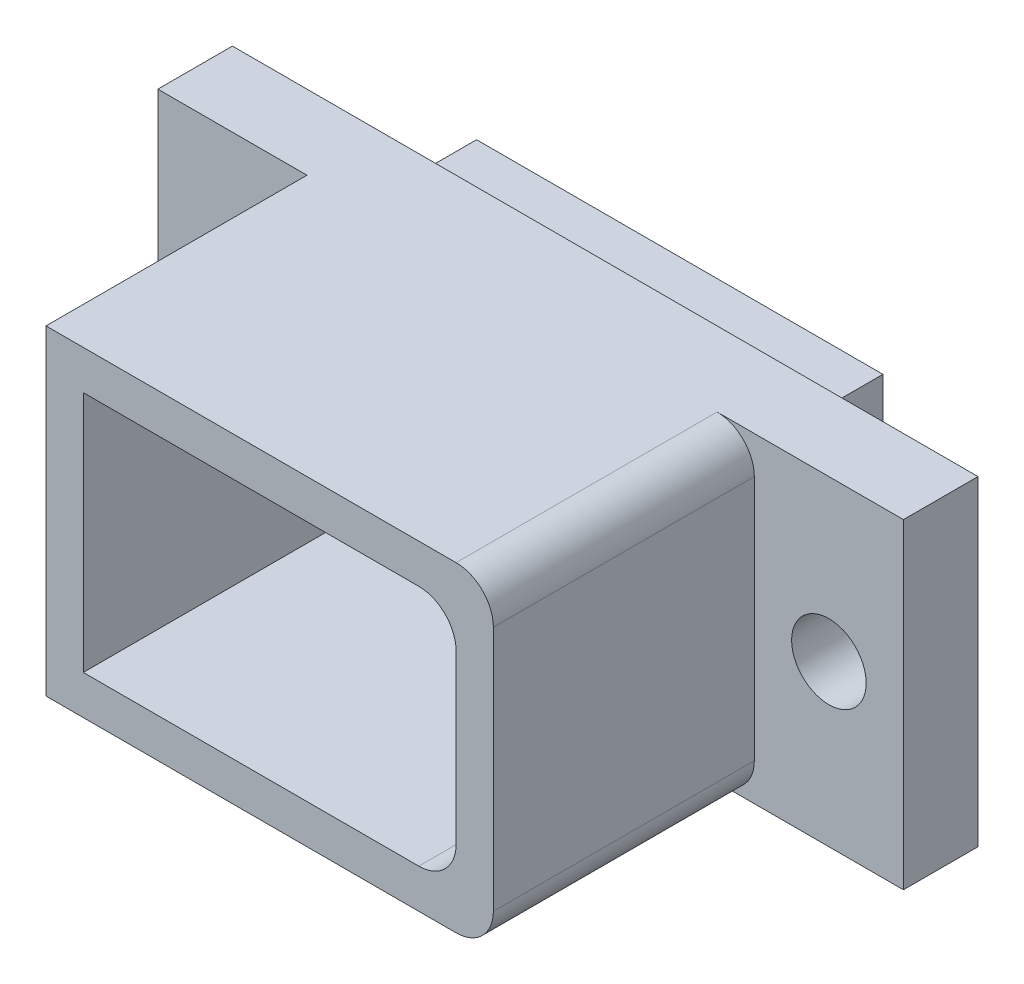
from build123d import *

# Parameters (mm, degrees)
SKETCH_1_W      = 10.9
SKETCH_1_H      = 6.8
SKETCH_1_R      = 0.5
EXTRUDE_1_DEPTH = 2
SKETCH_2_W      = 20
SKETCH_2_H      = 8.6
SKETCH_2_R      = 1
SKETCH_2_R_2    = 0.5
EXTRUDE_2_DEPTH = 2
EXTRUDE_3_DEPTH = 7


with BuildPart() as part:
    # 草图1 → 凸台-拉伸1 (new body)
    with BuildSketch(Plane.XY):
        Rectangle(SKETCH_1_W, SKETCH_1_H)
        with Locations((-3, 1.5)):
            Circle(SKETCH_1_R, mode=Mode.SUBTRACT)
        with Locations((0, 1.5)):
            Circle(SKETCH_1_R, mode=Mode.SUBTRACT)
        with Locations((3, 1.5)):
            Circle(SKETCH_1_R, mode=Mode.SUBTRACT)
        with Locations((0, -1.5)):
            Circle(SKETCH_1_R, mode=Mode.SUBTRACT)
        with Locations((3, -1.5)):
            Circle(SKETCH_1_R, mode=Mode.SUBTRACT)
        with Locations((-3, -1.5)):
            Circle(SKETCH_1_R, mode=Mode.SUBTRACT)
    extrude(amount=EXTRUDE_1_DEPTH)

    # 草图2 → 凸台-拉伸2 (add)
    with BuildSketch(Plane.XY.offset(2)):
        Rectangle(SKETCH_2_W, SKETCH_2_H)
        with Locations((-8, 0)):
            Circle(SKETCH_2_R, mode=Mode.SUBTRACT)
        with Locations(Location((8, 0, 0), (0, 0, 180))):
            Circle(SKETCH_2_R, mode=Mode.SUBTRACT)
        with Locations((3, 1.5)):
            Circle(SKETCH_2_R_2, mode=Mode.SUBTRACT)
        with Locations((3, -1.5)):
            Circle(SKETCH_2_R_2, mode=Mode.SUBTRACT)
        with Locations((0, -1.5)):
            Circle(SKETCH_2_R_2, mode=Mode.SUBTRACT)
        with Locations((0, 1.5)):
            Circle(SKETCH_2_R_2, mode=Mode.SUBTRACT)
        with Locations((-3, -1.5)):
            Circle(SKETCH_2_R_2, mode=Mode.SUBTRACT)
        with Locations((-3, 1.5)):
            Circle(SKETCH_2_R_2, mode=Mode.SUBTRACT)
    extrude(amount=EXTRUDE_2_DEPTH)

    # 草图3 → 凸台-拉伸3 (add)
    with BuildSketch(Plane.XY.offset(4)):
        with BuildLine():
            Line((5, 4.3), (-6, 4.3))
            Line((-6, 4.3), (-6, -4.3))
            Line((-6, -4.3), (5, -4.3))
            ThreePointArc((5, -4.3), (5.707106781, -4.007106781), (6, -3.3))
            Line((6, -3.3), (6, 3.3))
            ThreePointArc((6, 3.3), (5.707106781, 4.007106781), (5, 4.3))
        make_face()
        with BuildLine():
            Line((-5, -3.25), (-5, 3.25))
            Line((-5, 3.25), (4, 3.25))
            ThreePointArc((4, 3.25), (4.707106781, 2.957106781), (5, 2.25))
            Line((5, 2.25), (5, -2.25))
            ThreePointArc((5, -2.25), (4.707106781, -2.957106781), (4, -3.25))
            Line((4, -3.25), (-5, -3.25))
        make_face(mode=Mode.SUBTRACT)
    extrude(amount=EXTRUDE_3_DEPTH)


solid = part.part
